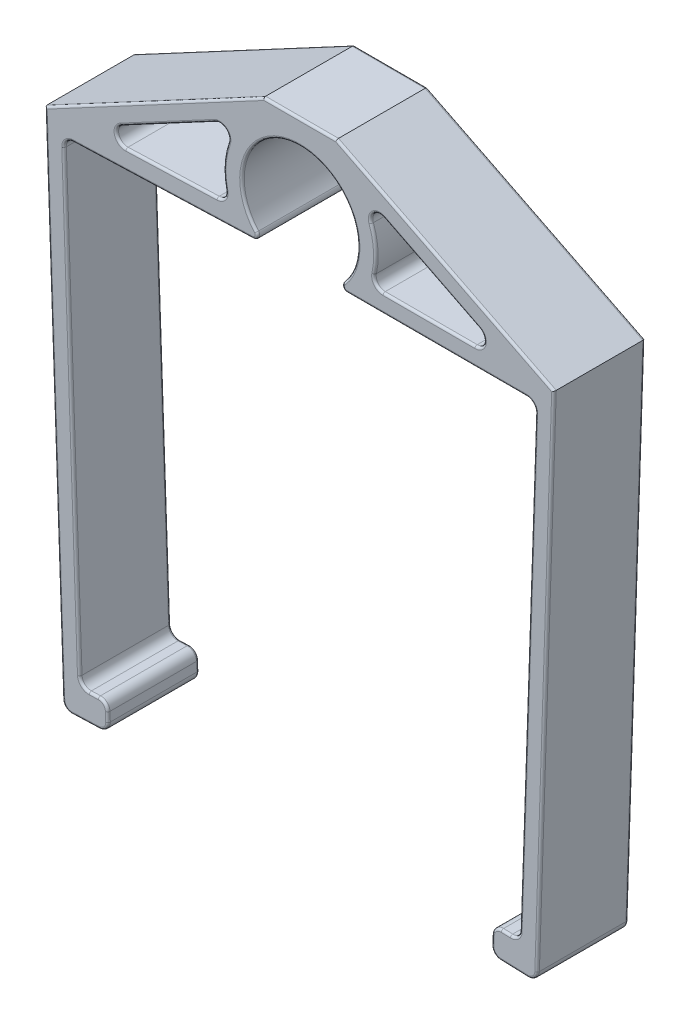
from build123d import *

# Parameters (mm, degrees)
BOSS_EXTRUDE1_DEPTH = 5
FILLET1_R           = 0.5
FILLET2_R           = 0.25
FILLET3_R           = 0.125


with BuildPart() as part:
    # Sketch1 → Boss-Extrude1 (new body)
    with BuildSketch(Plane.XY):
        with BuildLine():
            Line((1.957198253, -2.5), (12.950000003, -2.5))
            Line((12.950000003, -2.5), (12.059786159, -28.557438959))
            Line((12.059786159, -28.557438959), (10.560699918, -28.505089714))
            Line((10.560699918, -28.505089714), (10.508350673, -30.004175955))
            Line((10.508350673, -30.004175955), (13.006827741, -30.091424697))
            Line((13.006827741, -30.091424697), (13.950000003, -1.5))
            Line((13.950000003, -1.5), (2, 4.5))
            Line((2, 4.5), (0, 4.5))
            Line((0, 4.5), (-2, 4.5))
            Line((-2, 4.5), (-13.990993548, -1.908603375))
            Line((-13.990993548, -1.908603375), (-13.006827741, -30.091424697))
            Line((-13.006827741, -30.091424697), (-10.508350673, -30.004175955))
            Line((-10.508350673, -30.004175955), (-10.560699918, -28.505089714))
            Line((-10.560699918, -28.505089714), (-12.059786159, -28.557438959))
            Line((-12.059786159, -28.557438959), (-12.956703224, -2.873094705))
            Line((-12.956703224, -2.873094705), (-1.970597992, -2.489451457))
            ThreePointArc((-1.970597992, -2.489451457), (0.008526793, 3.17498855), (1.957198253, -2.5))
        make_face()
        with BuildLine():
            Line((3.896232154, -1.5), (11.721382469, -1.5))
            Line((11.721382469, -1.5), (3.04497101, 2.856357217))
            ThreePointArc((3.04497101, 2.856357217), (4.0975038, 0.800679467), (3.896232154, -1.5))
        make_face(mode=Mode.SUBTRACT)
        with BuildLine():
            Line((-3.896232154, -1.5), (-11.706362717, -1.772735769))
            Line((-11.706362717, -1.772735769), (-3.04497101, 2.856357217))
            ThreePointArc((-3.04497101, 2.856357217), (-4.0975038, 0.800679467), (-3.896232154, -1.5))
        make_face(mode=Mode.SUBTRACT)
    extrude(amount=BOSS_EXTRUDE1_DEPTH)

    # Fillet1
    fillet1_edges = [part.edges().sort_by_distance(p)[0] for p in [
        (11.721382469, -1.5, 2.5),
        (3.04497101, 2.856357217, 2.5),
        (3.896232154, -1.5, 2.5),
        (-11.706362717, -1.772735769, 2.5),
        (-3.896232154, -1.5, 2.5),
        (-3.04497101, 2.856357217, 2.5),
        (-12.956703224, -2.873094705, 2.5),
        (-12.059786159, -28.557438959, 2.5),
        (-10.560699918, -28.505089714, 2.5),
        (-10.508350673, -30.004175955, 2.5),
        (-13.006827741, -30.091424697, 2.5),
        (13.006827741, -30.091424697, 2.5),
        (10.508350673, -30.004175955, 2.5),
        (10.560699918, -28.505089714, 2.5),
        (12.059786159, -28.557438959, 2.5),
        (12.950000003, -2.5, 2.5),
    ]]
    fillet(fillet1_edges, radius=FILLET1_R)

    # Fillet2
    fillet2_edges = [part.edges().sort_by_distance(p)[0] for p in [
        (-1.970597992, -2.489451457, 2.5),
        (1.957198253, -2.5, 2.5),
    ]]
    fillet(fillet2_edges, radius=FILLET2_R)

    # Fillet3
    fillet3_edges = [part.edges().sort_by_distance(p)[0] for p in [
        (11.918299852, -28.405828462, 0),
        (11.918299852, -28.405828462, 5),
        (12.792165065, -2.652534822, 0),
        (12.792165065, -2.652534822, 5),
        (-11.918539674, -28.405970648, 0),
        (-11.918539674, -28.405970648, 5),
        (-12.805234913, -3.01434119, 0),
        (-12.805234913, -3.01434119, 5),
        (-4.080372502, 1.940892575, 0),
        (-4.080372502, 1.940892575, 5),
        (-4.165997407, -1.328562802, 0),
        (-4.165997407, -1.328562802, 5),
        (-10.052712176, -1.327748706, 0),
        (-10.052712176, -1.327748706, 5),
        (10.097768642, -1.115283296, 0),
        (10.097768642, -1.115283296, 5),
        (4.050063484, 1.997283815, 0),
        (4.050063484, 1.997283815, 5),
        (4.177260343, -1.313467753, 0),
        (4.177260343, -1.313467753, 5),
        (7.507448914, -2.5, 0),
        (7.507448914, -2.5, 5),
        (-0.006369813, 3.17499361, 0),
        (-7.510752686, -2.682917922, 0),
        (-2.343700353, -2.359437141, 0),
        (2.35472086, -2.35354131, 0),
        (-0.006369813, 3.17499361, 5),
        (-7.510752686, -2.682917922, 5),
        (-2.343700353, -2.359437141, 5),
        (2.35472086, -2.35354131, 5),
        (-7.995496774, 1.295698313, 0),
        (0, 4.5, 0),
        (7.975000001, 1.5, 0),
        (7.975000001, 1.5, 5),
        (0, 4.5, 5),
        (-7.995496774, 1.295698313, 5),
        (11.310053995, -28.531257735, 0),
        (11.310053995, -28.531257735, 5),
        (12.504602943, -15.537212098, 0),
        (12.504602943, -15.537212098, 5),
        (13.486672302, -15.545365409, 0),
        (13.486672302, -15.545365409, 5),
        (-12.508244691, -15.715266832, 0),
        (-11.310243038, -28.531264337, 0),
        (-10.534525296, -29.254632835, 0),
        (-11.757589207, -30.047800326, 0),
        (-13.507635518, -15.750166329, 0),
        (11.757106384, -30.047783465, 0),
        (10.534525296, -29.254632835, 0),
        (-7.223822763, 0.622964017, 0),
        (-7.048350864, -1.610074411, 0),
        (-4.167483343, 0.250414827, 0),
        (7.089018145, -1.5, 0),
        (7.221763432, 0.759222947, 0),
        (4.164865604, 0.290722376, 0),
        (-10.701946403, -28.656558025, 0),
        (-10.659818984, -29.86292947, 0),
        (-12.865581255, -29.939956386, 0),
        (10.701946403, -28.656558025, 0),
        (10.659818984, -29.86292947, 0),
        (12.86496844, -29.939593328, 0),
        (11.757106384, -30.047783465, 5),
        (10.534525296, -29.254632835, 5),
        (-13.507635518, -15.750166329, 5),
        (-11.757589207, -30.047800326, 5),
        (-10.534525296, -29.254632835, 5),
        (-11.310243038, -28.531264337, 5),
        (-12.508244691, -15.715266832, 5),
        (-7.223822763, 0.622964017, 5),
        (-4.167483343, 0.250414827, 5),
        (-7.048350864, -1.610074411, 5),
        (7.089018145, -1.5, 5),
        (4.164865604, 0.290722376, 5),
        (7.221763432, 0.759222947, 5),
        (-10.701946403, -28.656558025, 5),
        (-10.659818984, -29.86292947, 5),
        (-12.865581255, -29.939956386, 5),
        (10.701946403, -28.656558025, 5),
        (10.659818984, -29.86292947, 5),
        (12.86496844, -29.939593328, 5),
    ]]
    fillet(fillet3_edges, radius=FILLET3_R)


solid = part.part
